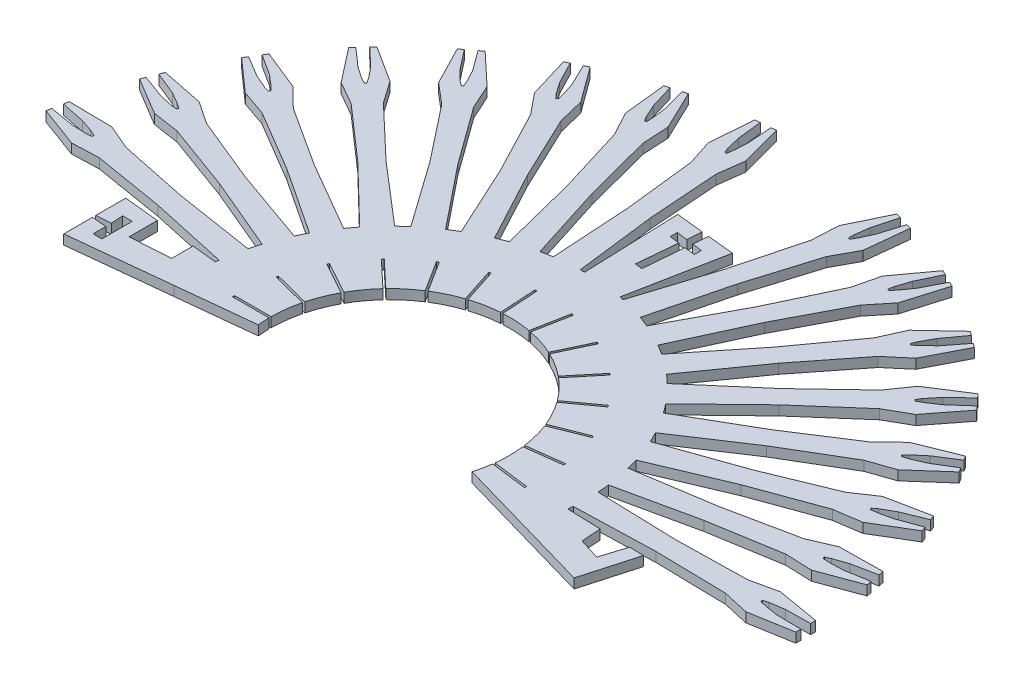
from build123d import *

# Parameters (mm, degrees)
SKETCH2_R               = 6.200163369
BOSS_EXTRUDE1_DEPTH     = 0.5
BOSS_EXTRUDE2_DEPTH     = 0.5
BOSS_EXTRUDE3_DEPTH     = 0.5
CIRPATTERN1_COUNT       = 18
CIRPATTERN1_ANGLE       = 180
CUT_EXTRUDE4_DEPTH      = 103.385536826
CUT_EXTRUDE4_DEPTH_BACK = 0.5
CUT_EXTRUDE6_DEPTH      = 103.385536826
CUT_EXTRUDE6_DEPTH_BACK = 0.5
CUT_EXTRUDE13_DEPTH     = 10
SKETCH13_R              = 2.29112386
SKETCH13_W              = 5.561420579
SKETCH13_H              = 0.106651934
CUT_EXTRUDE14_DEPTH     = 103.385536826


with BuildPart() as part:
    # Sketch2 → Boss-Extrude1 (new body)
    with BuildSketch(Plane(origin=(0, 0, 0), x_dir=(1, 0, 0), z_dir=(0, 1, 0))):
        with BuildLine():
            Line((41.736564116, 50.95828476), (36.555246465, 51.501399508))
            Line((36.555246465, 51.501399508), (36.555246465, 48.286890075))
            Line((36.555246465, 48.286890075), (41.732722408, 48.833722572))
            ThreePointArc((41.732722408, 48.833722572), (41.733244647, 48.828783324), (41.733769301, 48.82384433))
            ThreePointArc((41.733769301, 48.82384433), (50.963390645, 39.773597615), (61.612393233, 47.101054176))
            Line((61.612393233, 47.101054176), (66.500703475, 45.70083261))
            Line((66.500703475, 45.70083261), (67.011967053, 48.840095645))
            Line((67.011967053, 48.840095645), (61.960868148, 49.001189769))
            ThreePointArc((61.960868148, 49.001189769), (59.963353335, 56.003029367), (53.794021492, 59.87022057))
            Line((53.794021492, 59.87022057), (54.740102943, 64.742398272))
            Line((54.740102943, 64.742398272), (51.585987879, 65.064191003))
            Line((51.585987879, 65.064191003), (51.764987526, 60.059419928))
            ThreePointArc((51.764987526, 60.059419928), (45.016500937, 57.426340658), (41.737479755, 50.966991019))
            ThreePointArc((41.737479755, 50.966991019), (41.737020998, 50.962637988), (41.736564116, 50.95828476))
        make_face()
        with Locations(Location((51.841, 49.9, 0), (0, 0, 270))):
            Circle(SKETCH2_R, mode=Mode.SUBTRACT)
    extrude(amount=BOSS_EXTRUDE1_DEPTH)

    # Sketch3 → Boss-Extrude2 (add)
    with BuildSketch(Plane(origin=(0, 0, 0), x_dir=(1, 0, 0), z_dir=(0, 1, 0))):
        Polygon((32.227287846, 50.031148161), (31.574301661, 50.133558432), (30.299517244, 50.153543502), (30.299517244, 50.415928363), (32.510696717, 50.79601807), (33.863142341, 50.491060026), (37.548970282, 50.417634847), (41.857469478, 50.546841292), (41.857469478, 49.253158708), (37.548970282, 49.382365153), (33.863142341, 49.308939974), (32.510696717, 49.00398193), (30.299517244, 49.384071637), (30.299517244, 49.646456498), (31.574301661, 49.666441568), (32.323022544, 49.778206625), (32.588103044, 49.852616566), (32.588103044, 49.947383434), align=None)
    boss_extrude2 = extrude(amount=BOSS_EXTRUDE2_DEPTH)

    # CirPattern1: Boss-Extrude2 ×18 about axis
    cirpattern1_axis = Axis((51.841, 0, -49.9), (0, -1, 0))
    for i in range(1, CIRPATTERN1_COUNT):
        add(boss_extrude2.rotate(cirpattern1_axis, i * CIRPATTERN1_ANGLE / (CIRPATTERN1_COUNT - 1)))

    # Sketch8 → Cut-Extrude4 (cut, two sides: drawn at the far end of the back side and taken through both)
    with BuildSketch(Plane(origin=(0, 0, 0), x_dir=(1, 0, 0), z_dir=(0, 1, 0)).offset(-CUT_EXTRUDE4_DEPTH_BACK)):
        Polygon((36.555246465, 48.286890075), (27.995570216, 47.169676763), (27.995570216, 52.890741223), (36.555246465, 51.501399508), (36.555246465, 48.753981284), align=None)
        Polygon((51.655565612, 72.526598057), (51.585987879, 65.064191003), (54.740102943, 64.742398272), (56.406958129, 72.526598057), align=None)
        Polygon((47.95502979, 51.501399508), (46.998338953, 48.798), (52.839188276, 46.161429513), (54.740102943, 51.719098387), align=None)
    extrude(amount=CUT_EXTRUDE4_DEPTH + CUT_EXTRUDE4_DEPTH_BACK, mode=Mode.SUBTRACT)


with BuildPart() as body_2:
    # Sketch5 → Boss-Extrude3 (new body)
    with BuildSketch(Plane(origin=(0, 0, 0), x_dir=(1, 0, 0), z_dir=(0, 1, 0))):
        Polygon((51.841, 49.9), (51.841, 47.98601508), (47.518666367, 49.9), align=None)
    extrude(amount=BOSS_EXTRUDE3_DEPTH)


with BuildPart() as cut_extrude6_tool:
    # Sketch9 → Cut-Extrude6 (new, two sides: drawn at the far end of the back side and taken through both)
    with BuildSketch(Plane(origin=(0, 0, 0), x_dir=(1, 0, 0), z_dir=(0, 1, 0)).offset(-CUT_EXTRUDE6_DEPTH_BACK)):
        Polygon((36.555246465, 48.286890075), (47.009139853, 49.390092422), (47.587964148, 50.49093808), (51.841, 49.9), (66.500703475, 45.70083261), (51.841, 34.857894493), align=None)
    extrude(amount=CUT_EXTRUDE6_DEPTH + CUT_EXTRUDE6_DEPTH_BACK)


with BuildPart() as part_1:
    add(part.part)

    # Cut-Extrude6: cut by cut_extrude6_tool
    add(cut_extrude6_tool.part, mode=Mode.SUBTRACT)

    # Sketch12 → Cut-Extrude13 (cut)
    with BuildSketch(Plane(origin=(0, 0, 0), x_dir=(1, 0, 0), z_dir=(0, 1, 0))):
        Polygon((36.555246465, 51.501399508), (38.377437868, 51.501399508), (38.377437868, 49.846380566), (40.450129226, 49.985069668), (40.450129226, 51.16915959), (37.317153392, 51.720562063), align=None)
        Polygon((66.036768105, 49.006664529), (65.095153252, 45.671159721), (66.958125451, 45.145241638), (67.462296373, 48.891444034), align=None)
        Polygon((53.08254989, 66.12808357), (52.948117152, 64.171821775), (52.385771098, 64.24300482), (52.385771098, 63.878888302), (52.896048123, 63.814296274), (52.708350835, 61.754583122), (53.087715457, 61.700660527), (53.262410471, 63.755183921), (53.814395603, 63.698049757), (53.814395603, 64.054600552), (53.300329713, 64.12534266), (53.473842648, 66.014949594), align=None)
        Polygon((65.273932949, 48.895526569), (64.858820111, 47.588272269), (63.761063297, 47.936860104), (63.677982038, 49.064928372), (65.504842158, 49.006664529), align=None)
        Polygon((35.431152546, 49.858633501), (37.312510157, 49.997193872), (37.266298078, 50.624656446), (37.766087028, 50.624656446), (37.766087028, 49.051172586), (37.312510157, 49.051172586), (37.312510157, 49.715786798), align=None)
    extrude(amount=CUT_EXTRUDE13_DEPTH, mode=Mode.SUBTRACT)

    # Sketch13 → Cut-Extrude14 (cut, through all)
    with BuildSketch(Plane(origin=(0, 0, 0), x_dir=(1, 0, 0), z_dir=(0, 1, 0))):
        with Locations((51.841102424, 49.89933139)):
            Circle(SKETCH13_R)
        Polygon((49.373582939, 50.469956344), (43.986884615, 51.853025401), (44.013407872, 51.956326668), (49.400106197, 50.573257612), align=None)
        with Locations((46.528485657, 49.891707937)):
            Rectangle(SKETCH13_W, SKETCH13_H)
        Polygon((49.593013257, 51.065676254), (44.719503253, 53.744911051), (44.770883214, 53.838370853), (49.644393218, 51.159136056), align=None)
        Polygon((49.953699285, 51.588110427), (45.899598159, 55.395164789), (45.972606432, 55.472910703), (50.026707557, 51.665856341), align=None)
        Polygon((50.432977793, 52.004432402), (47.453019629, 56.700095102), (47.543068835, 56.757242065), (50.523026999, 52.061579366), align=None)
        Polygon((51.000733951, 52.288483138), (49.282160479, 57.577708419), (49.383592496, 57.610665679), (51.102165967, 52.321440398), align=None)
        Polygon((51.62129355, 52.422414683), (51.272089063, 57.972861068), (51.378530543, 57.979557799), (51.727735031, 52.429111413), align=None)
        Polygon((52.255664549, 52.397811626), (53.297770848, 57.860724156), (53.402533683, 57.840739576), (52.360427384, 52.377827046), align=None)
        Polygon((52.863987086, 52.216219866), (55.2319248, 57.248343656), (55.328426355, 57.202933471), (52.960488641, 52.170809682), align=None)
        Polygon((53.408038017, 51.889049483), (56.953020911, 56.174197688), (57.035197638, 56.106215186), (53.490214744, 51.821066982), align=None)
        Polygon((53.853632622, 51.436857795), (58.352916383, 54.705778792), (58.415604817, 54.619495565), (53.916321056, 51.350574568), align=None)
        Polygon((54.172772553, 50.888057667), (59.343650635, 52.93535313), (59.382911831, 52.83619067), (54.212033749, 50.788895207), align=None)
        Polygon((54.345405075, 50.277132232), (59.862972191, 50.974163056), (59.876339223, 50.868352105), (54.358772106, 50.17132128), align=None)
        Polygon((54.36068305, 49.64246818), (59.878250167, 48.945437356), (59.864883135, 48.839626404), (54.347316019, 49.536657228), align=None)
        Polygon((54.217646509, 49.023943788), (59.388524591, 46.976648325), (59.349263396, 46.877485865), (54.178385314, 48.924781328), align=None)
        Polygon((53.925282963, 48.460423219), (58.424566723, 45.191502221), (58.36187829, 45.105218994), (53.862594529, 48.374139992), align=None)
        Polygon((53.501962688, 47.987314542), (57.046945581, 43.702166338), (56.964768854, 43.634183836), (53.41978596, 47.919332041), align=None)
        Polygon((52.974284454, 47.634344916), (55.342222168, 42.602221126), (55.245720613, 42.556810941), (52.877782899, 47.588934731), align=None)
        Polygon((52.375404226, 47.423692719), (53.417510525, 41.960780189), (53.31274769, 41.94079561), (52.270641391, 47.40370814), align=None)
        Polygon((51.742951851, 47.368594006), (51.393747363, 41.81814762), (51.287305883, 41.824844351), (51.63651037, 47.375290736), align=None)
        Polygon((51.116666637, 47.472510829), (49.398093165, 42.183285548), (49.296661149, 42.216242808), (51.01523462, 47.505468089), align=None)
        Polygon((50.535900388, 47.728913714), (47.555942224, 43.033251014), (47.465893018, 43.090397978), (50.445851182, 47.786060678), align=None)
        Polygon((50.037144783, 48.121691923), (45.983043657, 44.314637561), (45.910035385, 44.392383475), (49.96413651, 48.199437837), align=None)
        Polygon((49.651738471, 48.626165758), (44.778228467, 45.946930961), (44.726848506, 46.040390763), (49.60035851, 48.71962556), align=None)
        Polygon((49.403897948, 49.210637272), (44.017199624, 47.827568216), (43.990676366, 47.930869483), (49.377374691, 49.313938539), align=None)
    extrude(amount=CUT_EXTRUDE14_DEPTH, mode=Mode.SUBTRACT)


with BuildPart() as body_2_1:
    add(body_2.part)

    # Cut-Extrude6: cut by cut_extrude6_tool
    add(cut_extrude6_tool.part, mode=Mode.SUBTRACT)


solid = part_1.part
